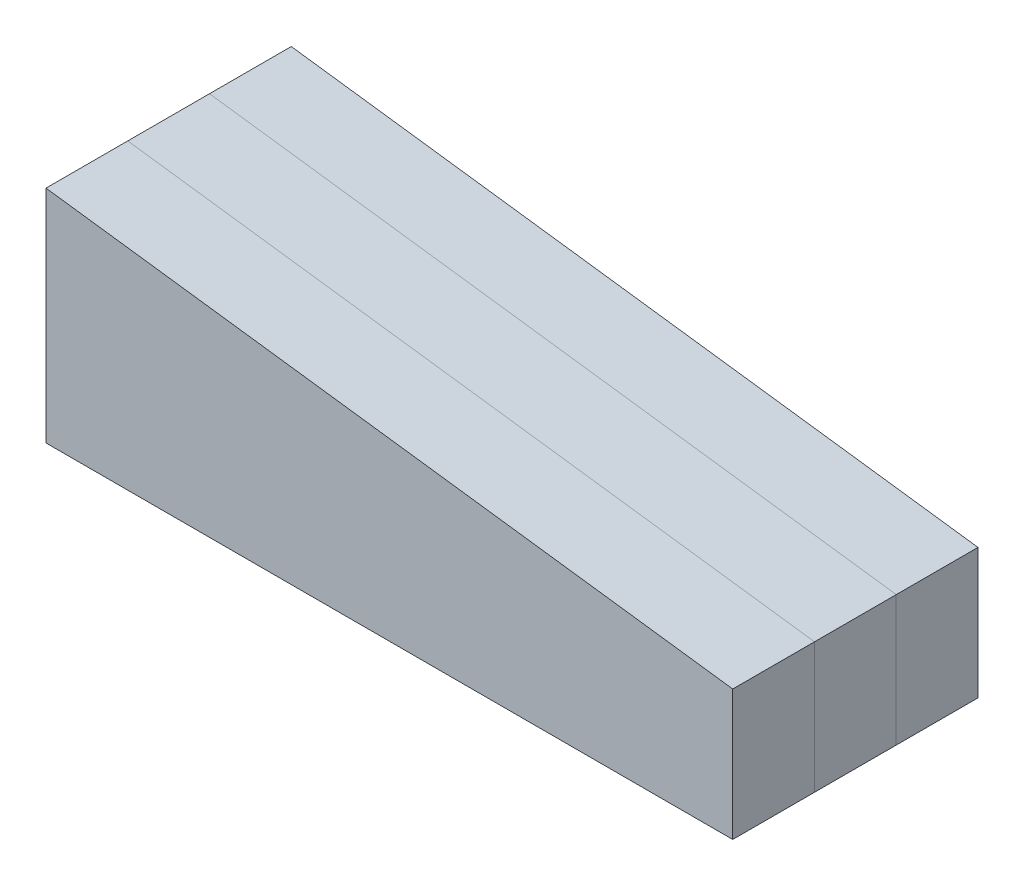
from build123d import *

# Parameters (mm, degrees)
BOSS_EXTRUDE1_DEPTH = 5.291666667
BOSS_EXTRUDE2_DEPTH = 10.583333333
BOSS_EXTRUDE3_DEPTH = 10.583333333


with BuildPart() as part:
    # Sketch1 → Boss-Extrude1 (new, symmetric)
    with BuildSketch(Plane.XY):
        Polygon((0, 0), (0, 28.575), (88.9, 16.871092964), (88.9, 0), align=None)
    extrude(amount=BOSS_EXTRUDE1_DEPTH, both=True)


with BuildPart() as body_2:
    # Sketch2 → Boss-Extrude2 (new body)
    with BuildSketch(Plane.XY.offset(5.291666667)):
        Polygon((88.9, 16.871092964), (0, 28.575), (0, 0), (88.9, 0), align=None)
    extrude(amount=BOSS_EXTRUDE2_DEPTH)


with BuildPart() as body_3:
    # Sketch3 → Boss-Extrude3 (new body)
    with BuildSketch(Plane.XY.offset(15.875)):
        Polygon((88.9, 0), (88.9, 16.871092964), (0, 28.575), (0, 0), align=None)
    extrude(amount=BOSS_EXTRUDE3_DEPTH)


solid = Compound([part.part, body_2.part, body_3.part])
